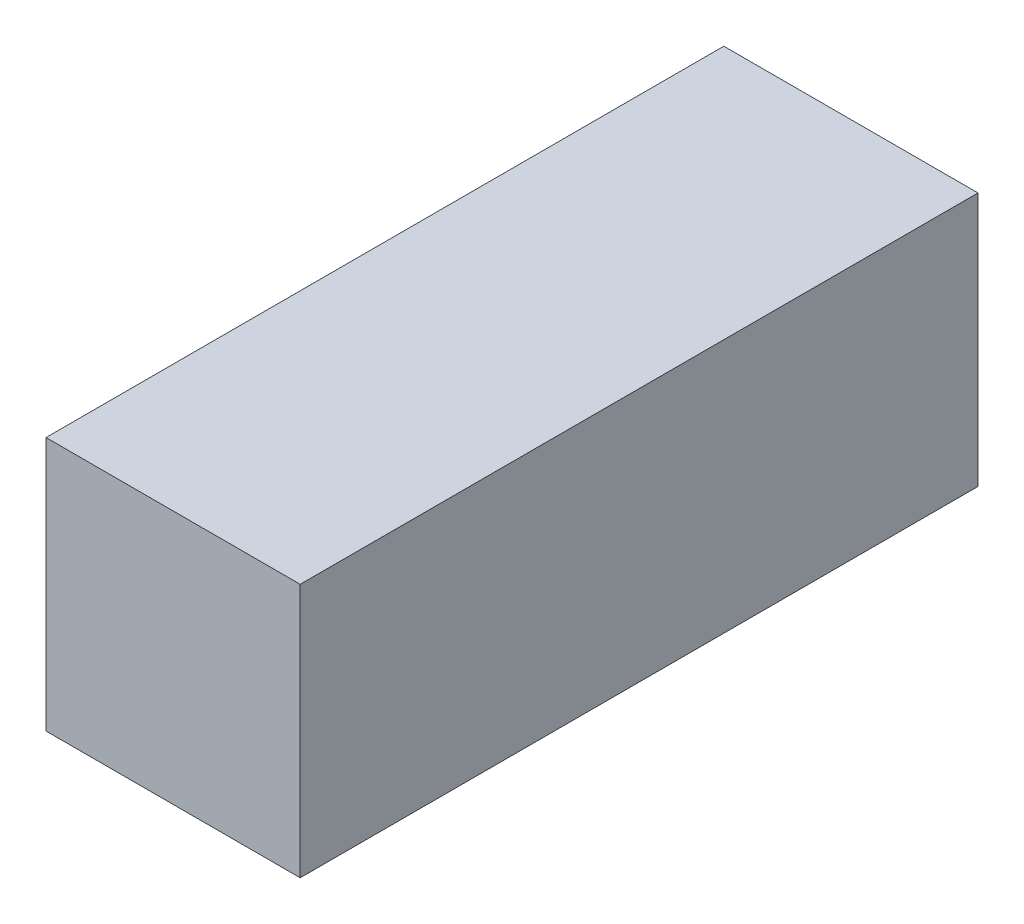
from build123d import *

# Parameters (mm, degrees)
SKETCH1_W           = 38.1
SKETCH1_H           = 38.1
BOSS_EXTRUDE1_DEPTH = 101.6


with BuildPart() as part:
    # Sketch1 → Boss-Extrude1 (new body)
    with BuildSketch(Plane.XY):
        with Locations((19.05, 19.05)):
            Rectangle(SKETCH1_W, SKETCH1_H)
    extrude(amount=BOSS_EXTRUDE1_DEPTH)


solid = part.part
